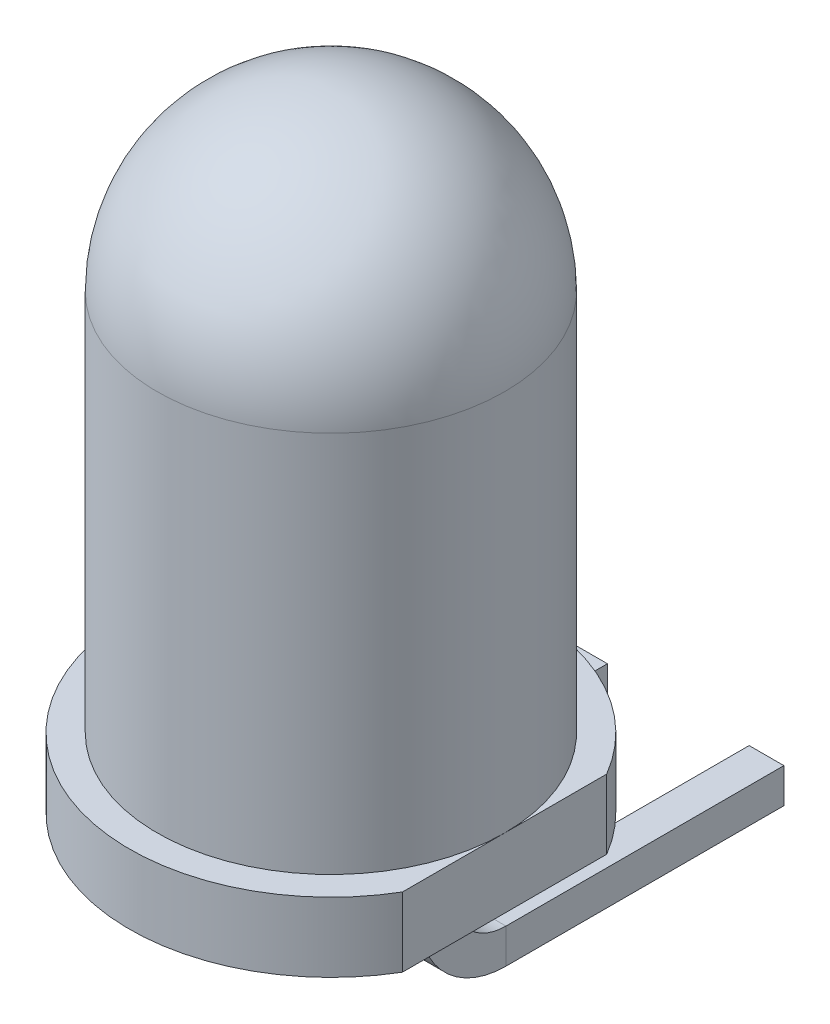
from build123d import *

# Parameters (mm, degrees)
SKETCH2_W          = 0.4
SKETCH2_H          = 2.939387692
CUT_EXTRUDE1_DEPTH = 10.890399385
SKETCH3_W          = 0.5
SKETCH3_H          = 0.5


with BuildPart() as part:
    # Sketch1 → Revolve1 (revolve)
    with BuildSketch(Plane(origin=(0, 0, 0), x_dir=(1, 0, 0), z_dir=(0, 0, -1)), mode=Mode.PRIVATE) as revolve1_sk:
        with BuildLine():
            Line((0, 0), (0, -9))
            ThreePointArc((0, -9), (1.767766953, -8.267766953), (2.5, -6.5))
            Line((2.5, -6.5), (2.5, -1))
            Line((2.5, -1), (2.9, -1))
            Line((2.9, -1), (2.9, 0))
            Line((2.9, 0), (0, 0))
        make_face()
    revolve(revolve1_sk.sketch.rotate(Axis((0, 0, 0), (0, 1, 0)), 90), axis=Axis((0, 0, 0), (0, 1, 0)))

    # Sketch2 → Cut-Extrude1 (cut, through all)
    with BuildSketch(Plane(origin=(0, 0, 0), x_dir=(-1, 0, 0), z_dir=(0, -1, 0))):
        with Locations((-2.7, 0)):
            Rectangle(SKETCH2_W, SKETCH2_H)
    extrude(amount=-CUT_EXTRUDE1_DEPTH, mode=Mode.SUBTRACT)

    # Sweep1: sweep along a path in Sketch4
    with BuildLine(Plane(origin=(-1.27, 0, 0), x_dir=(0, 0, -1), z_dir=(1, 0, 0))) as sweep1_path:
        Line((0, 0), (0, -0.4))
        ThreePointArc((0, -0.4), (0.292893219, -1.107106781), (1, -1.4))
        Line((1, -1.4), (5, -1.4))
    # Sketch3 → Sweep1 (sweep)
    with BuildSketch(Plane(origin=(0, 0, 0), x_dir=(-1, 0, 0), z_dir=(0, -1, 0))):
        with Locations((-1.27, 0)):
            Rectangle(SKETCH3_W, SKETCH3_H)
        with Locations((1.27, 0)):
            Rectangle(SKETCH3_W, SKETCH3_H)
    sweep(path=sweep1_path.line)


solid = part.part
